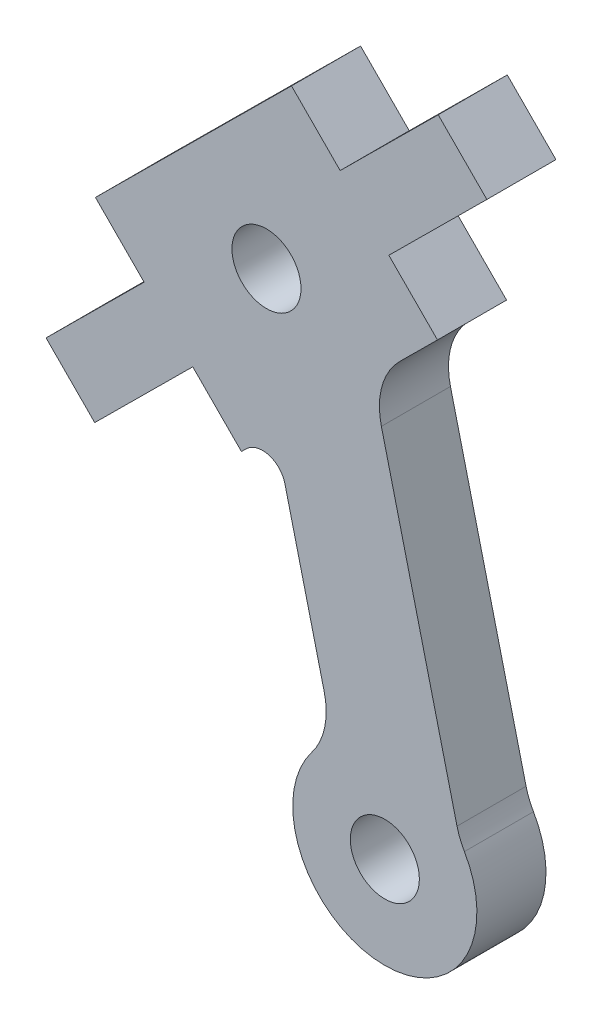
from build123d import *

# Parameters (mm, degrees)
ESQUISSE15_R        = 1.5
BOSS_EXTRU_15_DEPTH = 3


with BuildPart() as part:
    # Esquisse15 → Boss.-Extru.15 (new body)
    with BuildSketch(Plane.XY):
        with BuildLine():
            Line((159.079156624, -48.365258544), (150.563075986, -56.819628453))
            Line((150.563075986, -56.819628453), (152.676668463, -58.948648613))
            Line((152.676668463, -58.948648613), (148.418628144, -63.175833567))
            Line((148.418628144, -63.175833567), (150.532220621, -65.304853727))
            Line((150.532220621, -65.304853727), (154.790260941, -61.077668772))
            Line((154.790260941, -61.077668772), (156.903853418, -63.206688932))
            Line((156.903853418, -63.206688932), (157.114961916, -62.997110206))
            ThreePointArc((157.114961916, -62.997110206), (158.090398383, -62.744177685), (158.790743402, -63.468724451))
            Line((158.790743402, -63.468724451), (160.499830137, -70.44157839))
            ThreePointArc((160.499830137, -70.44157839), (160.521490891, -71.774910136), (159.963165383, -72.985907807))
            ThreePointArc((159.963165383, -72.985907807), (162.875303574, -79.417825737), (166.589129616, -73.413026553))
            ThreePointArc((166.589129616, -73.413026553), (166.3998932, -73.026858147), (166.267814939, -72.617600535))
            Line((166.267814939, -72.617600535), (162.983107766, -59.220583964))
            ThreePointArc((162.983107766, -59.220583964), (163.008961454, -57.693583939), (163.783215914, -56.377176889))
            Line((163.783215914, -56.377176889), (165.419934056, -54.752319023))
            Line((165.419934056, -54.752319023), (163.306341579, -52.623298863))
            Line((163.306341579, -52.623298863), (167.564381898, -48.396113909))
            Line((167.564381898, -48.396113909), (165.450789421, -46.267093749))
            Line((165.450789421, -46.267093749), (161.192749102, -50.494278704))
            Line((161.192749102, -50.494278704), (159.079156624, -48.365258544))
        make_face()
        with Locations((157.991505021, -55.785973738)):
            Circle(ESQUISSE15_R, mode=Mode.SUBTRACT)
        with Locations((163.132615018, -75.426110464)):
            Circle(ESQUISSE15_R, mode=Mode.SUBTRACT)
    extrude(amount=BOSS_EXTRU_15_DEPTH)


solid = part.part
